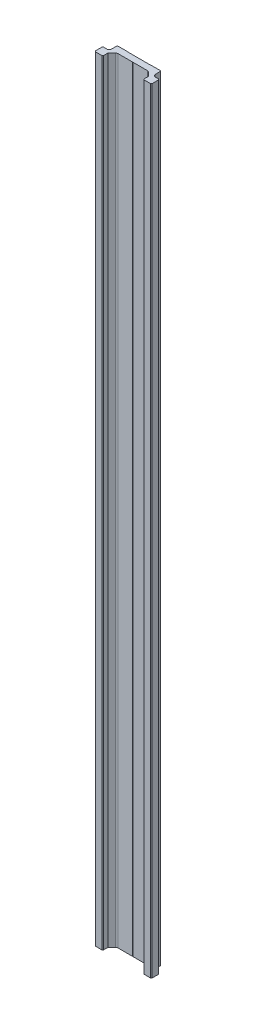
from build123d import *

# Parameters (mm, degrees)
BOSS_EXTRUDE1_DEPTH = 478


with BuildPart() as part:
    # Sketch1 → Boss-Extrude1 (new body)
    with BuildSketch(Plane(origin=(0, 200, 0), x_dir=(1, 0, 0), z_dir=(0, 1, 0))):
        with BuildLine():
            Line((1e-09, -3.855700002), (0.25, -4.00003757))
            Line((0.25, -4.00003757), (9.078700232, -4.00003757))
            ThreePointArc((9.078700232, -4.00003757), (9.652725366, -4.114218268), (10.139360377, -4.439377387))
            Line((10.139360377, -4.439377387), (12.500020747, -6.800037757))
            Line((12.500020747, -6.800037757), (12.500020747, -9.500037757))
            Line((12.500020747, -9.500037757), (13.00002072, -10.000037755))
            Line((13.00002072, -10.000037755), (17.00002072, -10.000037755))
            Line((17.00002072, -10.000037755), (17.500020747, -9.500037752))
            Line((17.500020747, -9.500037752), (17.500020747, -5.500037752))
            Line((17.500020747, -5.500037752), (17.00002075, -5.0000377))
            Line((17.00002075, -5.0000377), (14.30002072, -5.0000377))
            Line((14.30002072, -5.0000377), (14.085807141, -4.785824121))
            ThreePointArc((14.085807141, -4.785824121), (13.652261651, -4.136977442), (13.50002072, -3.371610598))
            Line((13.50002072, -3.371610598), (13.50002072, -0.30003757))
            Line((13.50002072, -0.30003757), (13.20002072, -3.757e-05))
            Line((13.20002072, -3.757e-05), (7.50002072, -3.757e-05))
            Line((7.50002072, -3.757e-05), (7.40002072, -0.10003757))
            Line((7.40002072, -0.10003757), (-7.40002072, -0.10003757))
            Line((-7.40002072, -0.10003757), (-7.50002072, -3.757e-05))
            Line((-7.50002072, -3.757e-05), (-13.20002072, -3.757e-05))
            Line((-13.20002072, -3.757e-05), (-13.50002072, -0.30003757))
            Line((-13.50002072, -0.30003757), (-13.50002072, -3.371610628))
            ThreePointArc((-13.50002072, -3.371610628), (-13.652261651, -4.136977472), (-14.085807141, -4.785824151))
            Line((-14.085807141, -4.785824151), (-14.30002069, -5.0000377))
            Line((-14.30002069, -5.0000377), (-17.00002072, -5.0000377))
            Line((-17.00002072, -5.0000377), (-17.50002072, -5.50003767))
            Line((-17.50002072, -5.50003767), (-17.50002072, -9.50003767))
            Line((-17.50002072, -9.50003767), (-17.000020665, -10.000037755))
            Line((-17.000020665, -10.000037755), (-13.00002072, -10.000037755))
            Line((-13.00002072, -10.000037755), (-12.500020741, -9.500037764))
            Line((-12.500020741, -9.500037764), (-12.500020741, -6.800037764))
            Line((-12.500020741, -6.800037764), (-10.139360364, -4.439377387))
            ThreePointArc((-10.139360364, -4.439377387), (-9.652725352, -4.114218268), (-9.078700218, -4.00003757))
            Line((-9.078700218, -4.00003757), (-0.25, -4.00003757))
            Line((-0.25, -4.00003757), (1e-09, -3.855700002))
        make_face()
    extrude(amount=-BOSS_EXTRUDE1_DEPTH)


solid = part.part
